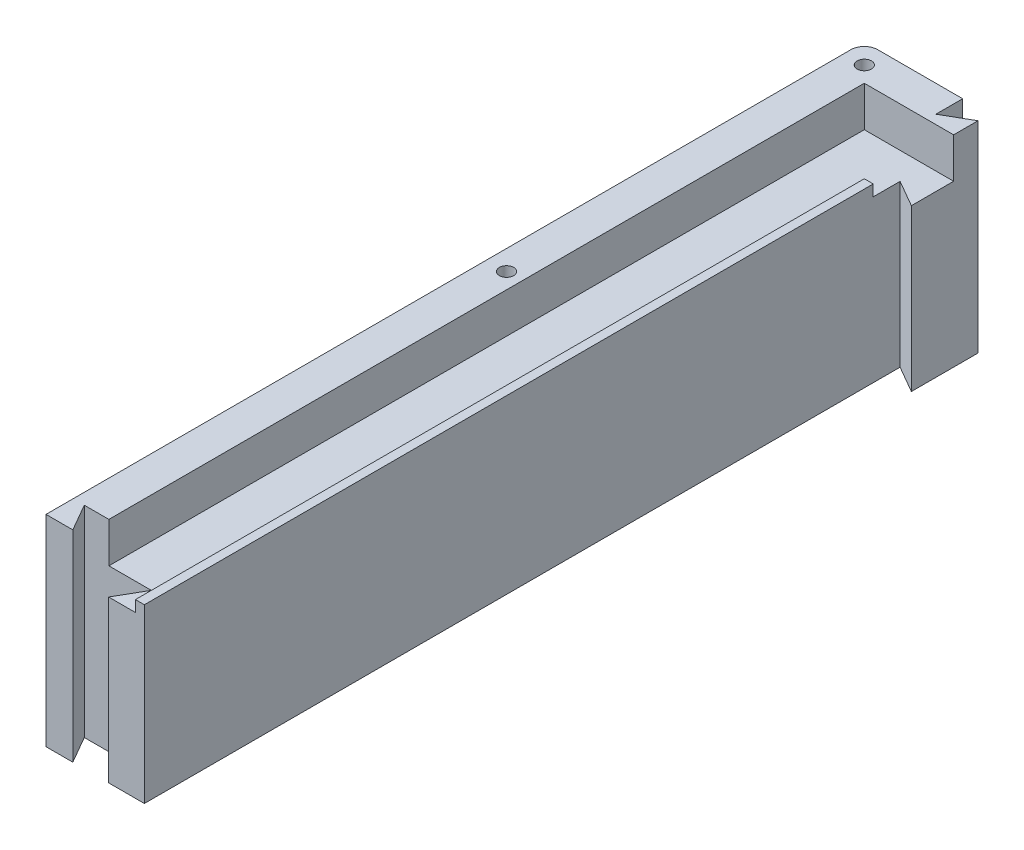
from build123d import *

# Parameters (mm, degrees)
SKETCH_1_W           = 270
SKETCH_1_H           = 370
SKETCH_1_W_2         = 250
SKETCH_1_H_2         = 350
EXTRUDE_2_DEPTH      = 45
SKETCH_4_W           = 250
SKETCH_4_H           = 350
SKETCH_4_W_2         = 222
SKETCH_4_H_2         = 322
EXTRUDE_3_DEPTH      = 5
SKETCH_9_W           = 246
SKETCH_9_H           = 346
SKETCH_9_W_2         = 226
SKETCH_9_H_2         = 326
CUT_EXTRUDE_3_DEPTH  = 2.5
SKETCH_12_R          = 1.6
CUT_EXTRUDE_5_DEPTH  = 109.5
FILLET_1_R           = 5
SKETCH_13_W          = 250
SKETCH_13_H          = 350
SKETCH_13_W_2        = 222
SKETCH_13_H_2        = 322
EXTRUDE_4_DEPTH      = 33.5
CUT_EXTRUDE_START    = -126.5
SKETCH_14_R          = 1.6
CUT_EXTRUDE_10_DEPTH = 126.5
CUT_EXTRUDE_11_DEPTH = 46
CUT_EXTRUDE_13_DEPTH = 2.5
SKETCH_17_R          = 1.6
CUT_EXTRUDE_14_DEPTH = 75.5


with BuildPart() as part:
    # 草图1 → 凸台-拉伸2 (new body)
    with BuildSketch(Plane(origin=(0, 0, 0), x_dir=(1, 0, 0), z_dir=(0, 1, 0))):
        with Locations((125, 175)):
            Rectangle(SKETCH_1_W, SKETCH_1_H)
        with Locations((125, 175)):
            Rectangle(SKETCH_1_W_2, SKETCH_1_H_2, mode=Mode.SUBTRACT)
    extrude(amount=EXTRUDE_2_DEPTH)

    # 草图4 → 凸台-拉伸3 (add)
    with BuildSketch(Plane(origin=(0, 38.5, 0), x_dir=(1, 0, 0), z_dir=(0, 1, 0))):
        with Locations((125, 175)):
            Rectangle(SKETCH_4_W, SKETCH_4_H)
        with Locations((125, 175)):
            Rectangle(SKETCH_4_W_2, SKETCH_4_H_2, mode=Mode.SUBTRACT)
    extrude(amount=-EXTRUDE_3_DEPTH)

    # 草图9 → 切除-拉伸3 (cut)
    with BuildSketch(Plane(origin=(0, 38.5, 0), x_dir=(1, 0, 0), z_dir=(0, 1, 0))):
        with Locations((125, 175)):
            Rectangle(SKETCH_9_W, SKETCH_9_H)
        with Locations((125, 175)):
            Rectangle(SKETCH_9_W_2, SKETCH_9_H_2, mode=Mode.SUBTRACT)
    extrude(amount=-CUT_EXTRUDE_3_DEPTH, mode=Mode.SUBTRACT)

    # 草图12 → 切除-拉伸5 (cut)
    with BuildSketch(Plane(origin=(0, 45, 0), x_dir=(1, 0, 0), z_dir=(0, 1, 0))):
        with Locations(Location((-3.535533906, -3.535533906, 0), (0, 0, 270))):
            Circle(SKETCH_12_R)
        with BuildLine():
            ThreePointArc((-4.666904756, 354.666904756), (-4.666904756, 352.404163056), (-2.404163056, 352.404163056))
            Line((-2.404163056, 352.404163056), (-4.666904756, 354.666904756))
        make_face()
        with BuildLine():
            Line((-4.666904756, 354.666904756), (-2.404163056, 352.404163056))
            ThreePointArc((-2.404163056, 352.404163056), (-2.057326654, 352.923240414), (-1.935533906, 353.535533906))
            ThreePointArc((-1.935533906, 353.535533906), (-2.923240414, 355.013741158), (-4.666904756, 354.666904756))
        make_face()
        with Locations(Location((253.535533906, 353.535533906, 0), (0, 0, 270))):
            Circle(SKETCH_12_R)
        with Locations(Location((253.535533906, -3.535533906, 0), (0, 0, 270))):
            Circle(SKETCH_12_R)
    extrude(amount=-CUT_EXTRUDE_5_DEPTH, mode=Mode.SUBTRACT)

    # 圆角1
    fillet_1_edges = [part.edges().sort_by_distance(p)[0] for p in [
        (-10, 22.5, 10),
        (-10, 22.5, -360),
        (260, 22.5, -360),
        (260, 22.5, 10),
    ]]
    fillet(fillet_1_edges, radius=FILLET_1_R)

    # 草图13 → 凸台-拉伸4 (add)
    with BuildSketch(Plane.XZ.offset(-33.5)):
        with Locations((125, -175)):
            Rectangle(SKETCH_13_W, SKETCH_13_H)
        with Locations((125, -175)):
            Rectangle(SKETCH_13_W_2, SKETCH_13_H_2, mode=Mode.SUBTRACT)
    extrude(amount=EXTRUDE_4_DEPTH)

    # 草图14 → 切除-拉伸10 (cut)
    # profile 1 of 10: a face of its own
    with BuildSketch(Plane.XZ.offset(CUT_EXTRUDE_START)):
        with BuildLine():
            Line((14, -175), (14, -14))
            Line((14, -14), (14, -6))
            Line((14, -6), (14, 2))
            Line((14, 2), (14, 10))
            Line((14, 10), (-5, 10))
            ThreePointArc((-5, 10), (-8.535533906, 8.535533906), (-10, 5))
            Line((-10, 5), (-10, -175))
            Line((-10, -175), (-2, -175))
            Line((-2, -175), (6, -175))
            Line((6, -175), (14, -175))
        make_face()
        with Locations((-3.535533906, 3.535533906)):
            Circle(SKETCH_14_R, mode=Mode.SUBTRACT)
    # profile 2 of 10: a face of its own
    with BuildSketch(Plane.XZ.offset(CUT_EXTRUDE_START)):
        Polygon((9.5, -181.062177826), (6, -175), (-2, -175), (-5.5, -181.062177826), align=None)
    # profile 3 of 10: a face of its own
    with BuildSketch(Plane.XZ.offset(CUT_EXTRUDE_START)):
        with Locations((-3.535533906, 3.535533906)):
            Circle(SKETCH_14_R)
    # profile 4 of 10: a face of its own
    with BuildSketch(Plane.XZ.offset(CUT_EXTRUDE_START)):
        Polygon((14, -6), (14, -14), (125, -14), (125, 10), (14, 10), (14, 2), (19.975575286, 5.45), (19.975575286, -9.45), align=None)
    # profile 5 of 10: a face of its own
    with BuildSketch(Plane.XZ.offset(CUT_EXTRUDE_START)):
        Polygon((14, 2), (14, -6), (19.975575286, -9.45), (19.975575286, 5.45), align=None)
    # profile 6 of 10: a face of its own
    with BuildSketch(Plane.XZ.offset(CUT_EXTRUDE_START)):
        Polygon((125, 10), (125, -14), (236, -14), (236, -6), (230.024424714, -9.45), (230.024424714, 5.45), (236, 2), (236, 10), align=None)
    # profile 7 of 10: a face of its own
    with BuildSketch(Plane.XZ.offset(CUT_EXTRUDE_START)):
        Polygon((230.024424714, -9.45), (236, -6), (236, 2), (230.024424714, 5.45), align=None)
    # profile 8 of 10: a face of its own
    with BuildSketch(Plane.XZ.offset(CUT_EXTRUDE_START)):
        with BuildLine():
            Line((236, -336), (14, -336))
            Line((14, -336), (14, -344))
            Line((14, -344), (19.975575286, -340.55))
            Line((19.975575286, -340.55), (19.975575286, -355.45))
            Line((19.975575286, -355.45), (14, -352))
            Line((14, -352), (14, -360))
            Line((14, -360), (255, -360))
            ThreePointArc((255, -360), (258.535533906, -358.535533906), (260, -355))
            Line((260, -355), (260, 5))
            ThreePointArc((260, 5), (258.535533906, 8.535533906), (255, 10))
            Line((255, 10), (236, 10))
            Line((236, 10), (236, 2))
            Line((236, 2), (236, -6))
            Line((236, -6), (236, -14))
            Line((236, -14), (236, -336))
        make_face()
        with Locations((253.535533906, -353.535533906)):
            Circle(SKETCH_14_R, mode=Mode.SUBTRACT)
        with Locations((253.535533906, 3.535533906)):
            Circle(SKETCH_14_R, mode=Mode.SUBTRACT)
    # profile 9 of 10: a face of its own
    with BuildSketch(Plane.XZ.offset(CUT_EXTRUDE_START)):
        with Locations((253.535533906, 3.535533906)):
            Circle(SKETCH_14_R)
    # profile 10 of 10: a face of its own
    with BuildSketch(Plane.XZ.offset(CUT_EXTRUDE_START)):
        with Locations((253.535533906, -353.535533906)):
            Circle(SKETCH_14_R)
    extrude(amount=CUT_EXTRUDE_10_DEPTH, mode=Mode.SUBTRACT)

    # 草图15 → 切除-拉伸11 (cut)
    with BuildSketch(Plane(origin=(0, 45, 0), x_dir=(1, 0, 0), z_dir=(0, 1, 0))):
        with BuildLine():
            Line((-5, 358), (12, 358))
            Line((12, 358), (14, 358))
            Line((14, 358), (14, 360))
            Line((14, 360), (-5, 360))
            ThreePointArc((-5, 360), (-8.535533906, 358.535533906), (-10, 355))
            Line((-10, 355), (-10, 175))
            Line((-10, 175), (-8, 175))
            Line((-8, 175), (-8, 177))
            Line((-8, 177), (-8, 355))
            ThreePointArc((-8, 355), (-7.121320344, 357.121320344), (-5, 358))
        make_face()
    extrude(amount=-CUT_EXTRUDE_11_DEPTH, mode=Mode.SUBTRACT)

    # 草图16 → 切除-拉伸13 (cut)
    with BuildSketch(Plane(origin=(0, 38.5, 0), x_dir=(1, 0, 0), z_dir=(0, 1, 0))):
        Polygon((19.975575286, 348), (19.975575286, 350), (0, 350), (0, 181.062177826), (2, 181.062177826), (2, 348), align=None)
    extrude(amount=-CUT_EXTRUDE_13_DEPTH, mode=Mode.SUBTRACT)

    # 草图17 → 切除-拉伸14 (cut)
    with BuildSketch(Plane(origin=(0, 45, 0), x_dir=(1, 0, 0), z_dir=(0, 1, 0))):
        with Locations(Location((-3.535533906, 273.535533906, 0), (0, 0, 270))):
            Circle(SKETCH_17_R)
    extrude(amount=-CUT_EXTRUDE_14_DEPTH, mode=Mode.SUBTRACT)


solid = part.part
